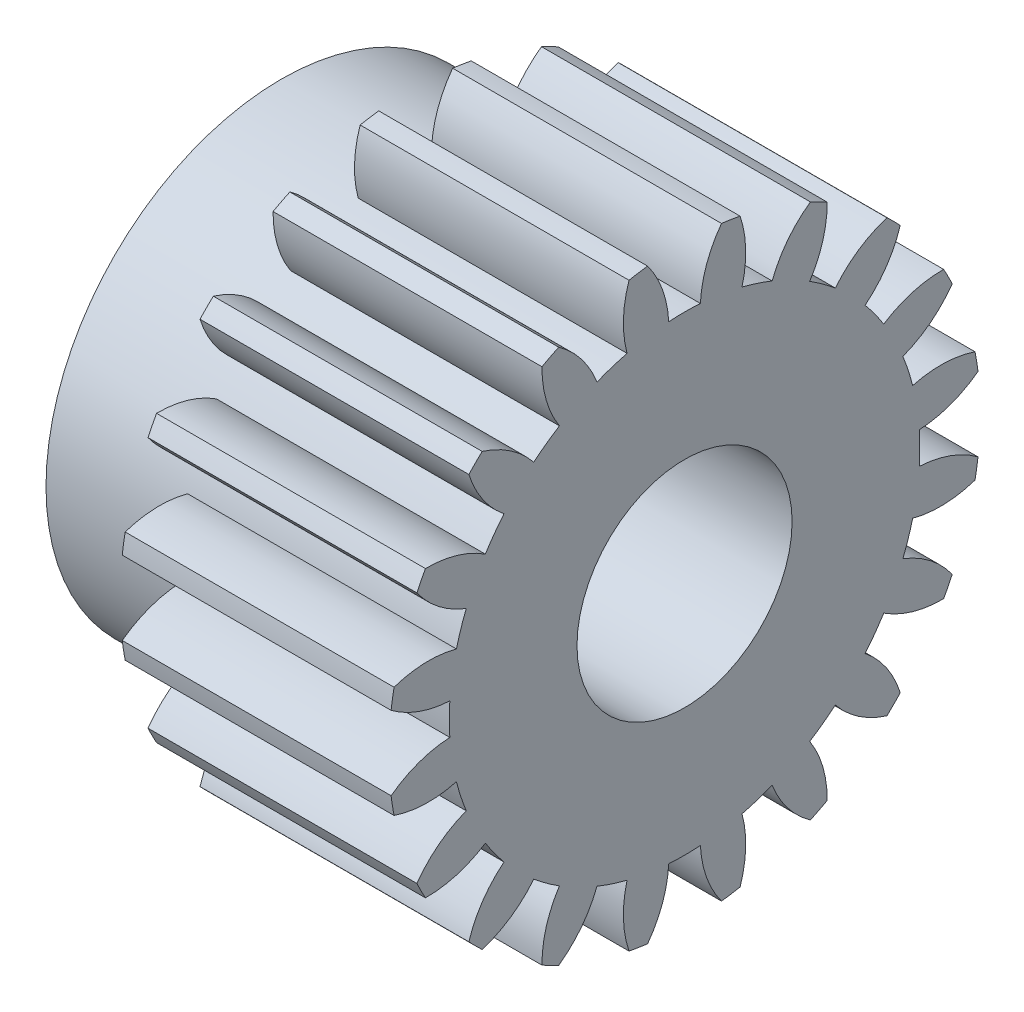
from build123d import *
from build123d.topology import SkipClean

# Parameters (mm, degrees)
BASPROSKE_W      = 10
BASPROSKE_H      = 11
TOOTHCUT_DEPTH   = 19.493242009
TEETHCUTS_COUNT  = 20
TEETHCUTS_ANGLE  = 342
HUBNEARONE_START = 5.000051
HUBNEAONESKE_R   = 8.749
HUBNEARONE_DEPTH = 5.000051
BORSKE_R         = 4
BORE_DEPTH       = 15.0000508


with BuildPart() as part:
    # BasProSke → Base-Revolve (revolve)
    with BuildSketch(Plane(origin=(0, 0, 0), x_dir=(1, 0, 0), z_dir=(0, 1, 0)), mode=Mode.PRIVATE) as base_revolve_sk:
        with Locations((5, 5.5)):
            Rectangle(BASPROSKE_W, BASPROSKE_H)
    revolve(base_revolve_sk.sketch.rotate(Axis((-10, 0, 0), (1, 0, 0)), 180), axis=Axis((-10, 0, 0), (1, 0, 0)))

    # TooCutSke → ToothCut (cut, through all)
    with BuildSketch(Plane(origin=(0, 0, 0), x_dir=(0, 0, -1), z_dir=(1, 0, 0))):
        with BuildLine():
            ThreePointArc((0.589353609, 8.729127295), (0, 8.749), (-0.589353609, 8.729127295))
            ThreePointArc((-0.589353609, 8.729127295), (-0.82475631, 9.893403384), (-1.391689312, 10.937213814))
            ThreePointArc((-1.391689312, 10.937213814), (0, 11.0254), (1.391689312, 10.937213814))
            ThreePointArc((1.391689312, 10.937213814), (0.82475631, 9.893403384), (0.589353609, 8.729127295))
        make_face()
    toothcut = extrude(amount=TOOTHCUT_DEPTH, mode=Mode.SUBTRACT)

    # TeethCuts: ToothCut ×20 about axis
    teethcuts_axis = Axis((-10, 0, 0), (1, 0, 0))
    for i in range(1, TEETHCUTS_COUNT):
        add(toothcut.rotate(teethcuts_axis, i * TEETHCUTS_ANGLE / (TEETHCUTS_COUNT - 1)), mode=Mode.SUBTRACT)

    # HubNeaOneSke → HubNearOne (add)
    with SkipClean():  # the faces are left unmerged after this step: merging them gives an invalid solid
        with BuildSketch(Plane.ZY.offset(HUBNEARONE_START)):
            Circle(HUBNEAONESKE_R)
        extrude(amount=-HUBNEARONE_DEPTH)

    # BorSke → Bore (cut, symmetric)
    with SkipClean():  # the faces are left unmerged after this step: merging them gives an invalid solid
        with BuildSketch(Plane(origin=(0, 0, 0), x_dir=(0, 0, -1), z_dir=(1, 0, 0))):
            with Locations(Location((0, 0, 0), (0, 0, 180))):
                Circle(BORSKE_R)
        extrude(amount=BORE_DEPTH, both=True, mode=Mode.SUBTRACT)


solid = part.part
